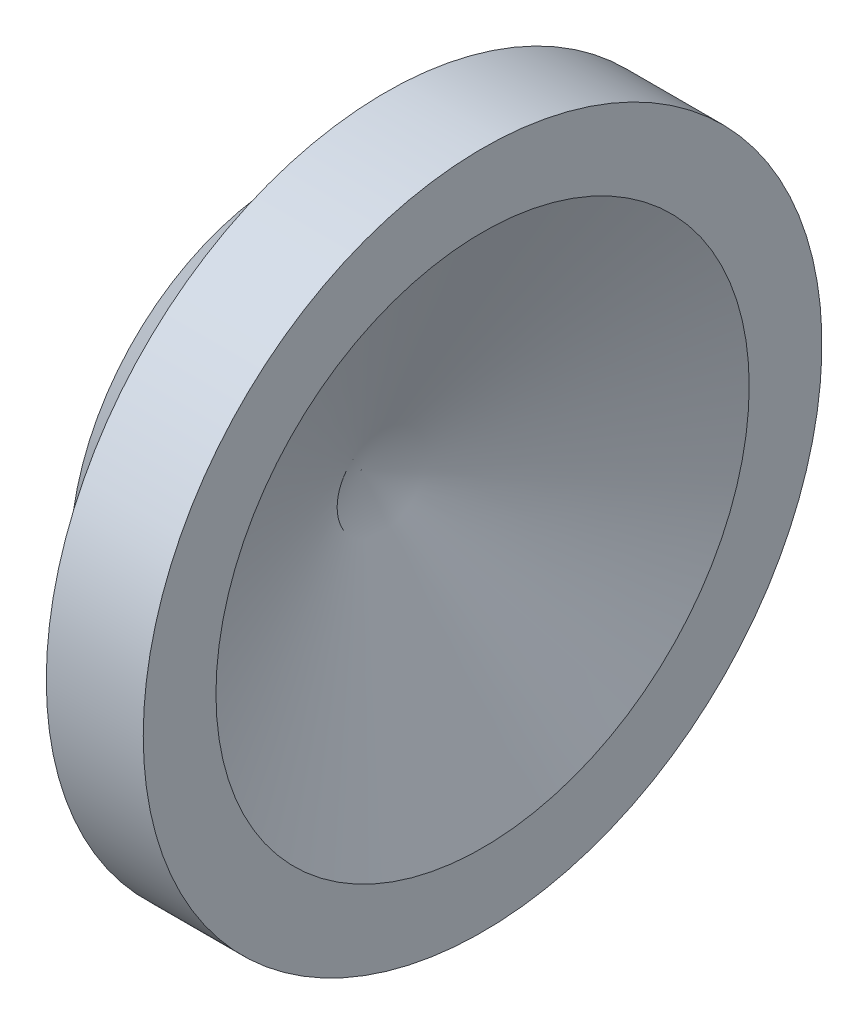
from build123d import *


with BuildPart() as part:
    # Sketch1 → Revolve1 (revolve)
    with BuildSketch(Plane(origin=(0, 0, 0), x_dir=(1, 0, 0), z_dir=(0, 1, 0))):
        Polygon((0, 0), (-0.75, 0), (-1, -0.25), (-1, 2), (-0.25, 2), (1, -0.75), (1, -1.5), (0, -1.5), align=None)
    revolve(axis=Axis((-1, 0, -2), (1, 0, 0)))


solid = part.part
